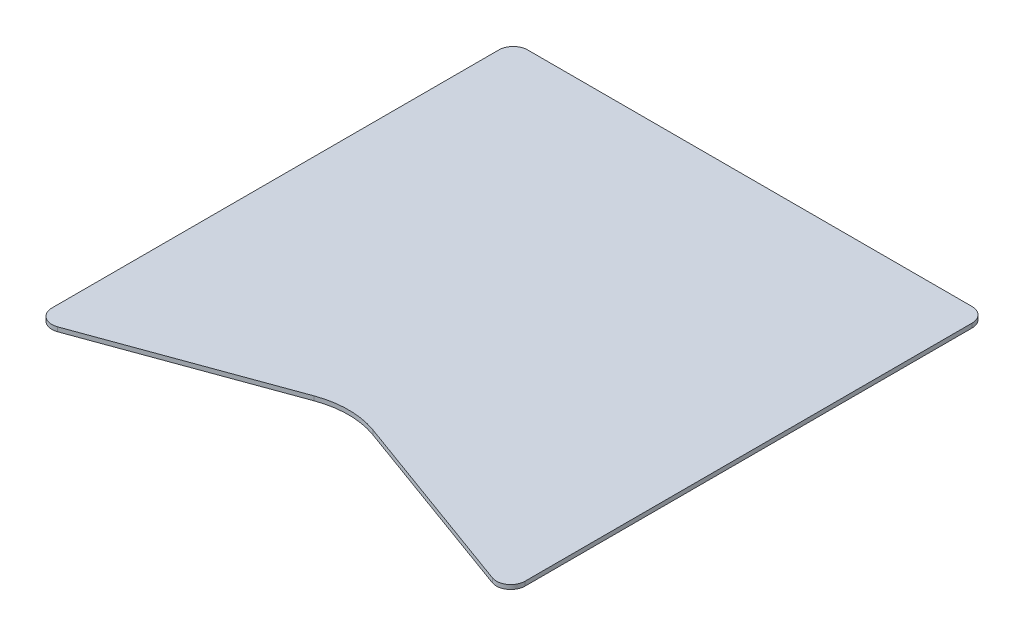
from build123d import *

# Parameters (mm, degrees)
BOSS_EXTRUDE1_DEPTH = 3
CUT_EXTRUDE3_DEPTH  = 535.143239216
SKETCH6_W           = 330
SKETCH6_H           = 70
CUT_EXTRUDE4_DEPTH  = 467.700117849
FILLET1_R           = 10


with BuildPart() as part:
    # Sketch3 → Boss-Extrude1 (new body)
    with BuildSketch(Plane(origin=(0, 0, 0), x_dir=(1, 0, 0), z_dir=(0, 1, 0))):
        with BuildLine():
            Line((-36.319194267, -89.236860887), (144.478790315, -23.431776084))
            ThreePointArc((144.478790315, -23.431776084), (165.000000077, -19.813332936), (185.52120983, -23.431776136))
            Line((185.52120983, -23.431776136), (366.319192052, -89.236860081))
            ThreePointArc((366.319192052, -89.236860081), (416.877444894, -67.142834059), (397.269838057, -15.569346002))
            Line((397.269838057, -15.569346002), (344.206351456, 9.829836443))
            ThreePointArc((344.206351456, 9.829836443), (333.847680817, 19.053826006), (330, 32.379717841))
            Line((330, 32.379717841), (330, 330))
            Line((330, 330), (0, 330))
            Line((0, 330), (0, 32.379717841))
            ThreePointArc((0, 32.379717841), (-3.847681031, 19.053825667), (-14.206352179, 9.829836096))
            Line((-14.206352179, 9.829836096), (-67.269835876, -15.569344958))
            ThreePointArc((-67.269835876, -15.569344958), (-86.877445819, -67.142831858), (-36.319194267, -89.236860887))
        make_face()
    extrude(amount=BOSS_EXTRUDE1_DEPTH)

    # Sketch5 → Cut-Extrude3 (cut, through all)
    with BuildSketch(Plane(origin=(0, 0, 0), x_dir=(1, 0, 0), z_dir=(0, 1, 0))):
        Polygon((330, -1291.92309226), (330, -91.649156055), (330, 58.350843945), (420, 58.350843945), (420, -91.649156055), (-90, -91.649156055), (-90, 58.350843945), (0, 58.350843945), (0, -91.649156055), (0, -1291.92309226), (0, -3692.47096467), (330, -3692.47096467), align=None)
    extrude(amount=CUT_EXTRUDE3_DEPTH, mode=Mode.SUBTRACT)


with BuildPart() as cut_extrude3_kept_piece:
    # of the separate pieces the step leaves, the one the design keeps (cut_extrude3_pieces_kept)
    add(part.part.solids().sort_by_distance((0, 0, -330))[0])

    # Sketch6 → Cut-Extrude4 (cut, through all)
    with BuildSketch(Plane(origin=(0, 3, 0), x_dir=(1, 0, 0), z_dir=(0, 1, 0))):
        with Locations((165, 295)):
            Rectangle(SKETCH6_W, SKETCH6_H)
    extrude(amount=-CUT_EXTRUDE4_DEPTH, mode=Mode.SUBTRACT)

    # Fillet1
    fillet1_edges = [cut_extrude3_kept_piece.edges().sort_by_distance(p)[0] for p in [
        (330, 1.5, 76.017755241),
        (0, 1.5, -260),
        (330, 1.5, -260),
        (0, 1.5, 76.017755241),
    ]]
    fillet(fillet1_edges, radius=FILLET1_R)


solid = cut_extrude3_kept_piece.part
